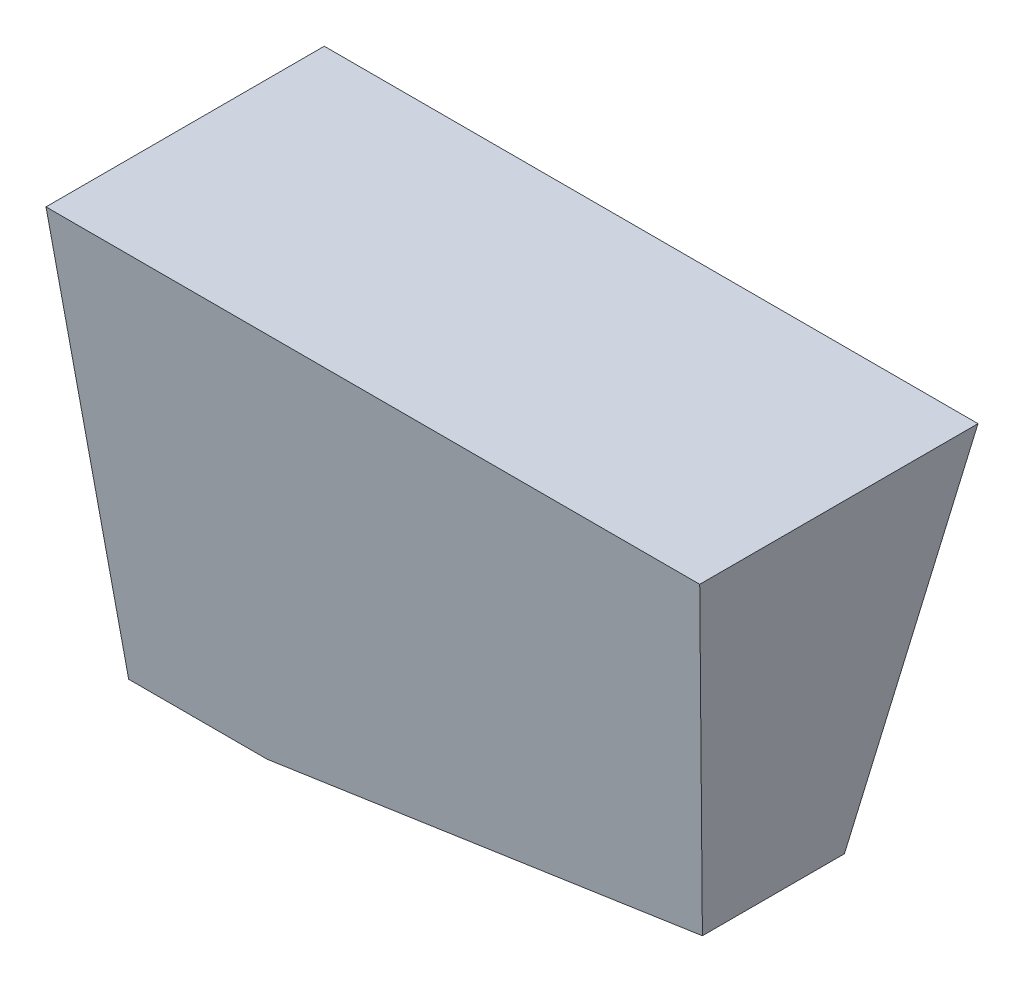
from build123d import *

# Parameters (mm, degrees)
TD_SKETCH_R                   = 0.792499939
TL_FEATURE_DEPTH              = 29.999999944
TDF_STD_SKETCH_W              = 1.604999838
TDF_STD_SKETCH_H              = 1.604999838
TDF_STD_FEATURE_DEPTH         = 31.02092785
ISA_20_STD_FEATURE_DEPTH      = 31.02092785
ISA_20_STD_FEATURE_DEPTH_BACK = 31.02092785
F_10BA_STD_FEATURE_DEPTH      = 31.02092785
F_10BA_STD_FEATURE_DEPTH_BACK = 31.02092785


with BuildPart() as part:
    # TD_sketch → TL_feature (new body)
    with BuildSketch(Plane(origin=(0, 0, 0), x_dir=(1, 0, 0), z_dir=(0, 1, 0))):
        with Locations(Location((0, 0, 0), (0, 0, 270))):
            Circle(TD_SKETCH_R)
    extrude(amount=TL_FEATURE_DEPTH)

    # TDF_STD_sketch → TDF_STD_feature (cut, through all)
    with BuildSketch(Plane(origin=(0, 0, 0), x_dir=(1, 0, 0), z_dir=(0, 1, 0))):
        with Locations((-1.17799993, 0)):
            Rectangle(TDF_STD_SKETCH_W, TDF_STD_SKETCH_H)
    extrude(amount=TDF_STD_FEATURE_DEPTH, mode=Mode.SUBTRACT)

    # ISA_20_STD_sketch → ISA_20_STD_feature (cut, two sides: drawn at the far end of the back side and taken through both)
    with BuildSketch(Plane(origin=(0, 0, 0), x_dir=(0, 0, -1), z_dir=(1, 0, 0)).offset(-ISA_20_STD_FEATURE_DEPTH_BACK)):
        Polygon((-18.416115078, 100.150819523), (-5.541030384, 29.999999944), (-0.035000057, 0), (0.035000057, 0), (5.541030384, 29.999999944), (18.416115078, 100.150819523), (18.416115078, -42.494268629), (-18.416115078, -42.494268629), align=None)
    extrude(amount=ISA_20_STD_FEATURE_DEPTH + ISA_20_STD_FEATURE_DEPTH_BACK, mode=Mode.SUBTRACT)

    # 10BA_STD_sketch → 10BA_STD_feature (cut, two sides: drawn at the far end of the back side and taken through both)
    with BuildSketch(Plane.XY.offset(-F_10BA_STD_FEATURE_DEPTH_BACK)):
        Polygon((-71.42876073, 0), (-0.375500011, 0), (-0.289499929, 0), (-0.010835963, 0.049135976), (5.27030945, 29.999999944), (17.608578692, 99.973801977), (123.729747966, 5.461575957), (34.692408544, -94.51222602), align=None)
    extrude(amount=F_10BA_STD_FEATURE_DEPTH + F_10BA_STD_FEATURE_DEPTH_BACK, mode=Mode.SUBTRACT)

    # cut_feature
    split(bisect_by=Plane(origin=(0, 0.279226503, 0), x_dir=(1, 0, 0), z_dir=(0, 1, 0)), keep=Keep.BOTTOM)


solid = part.part
